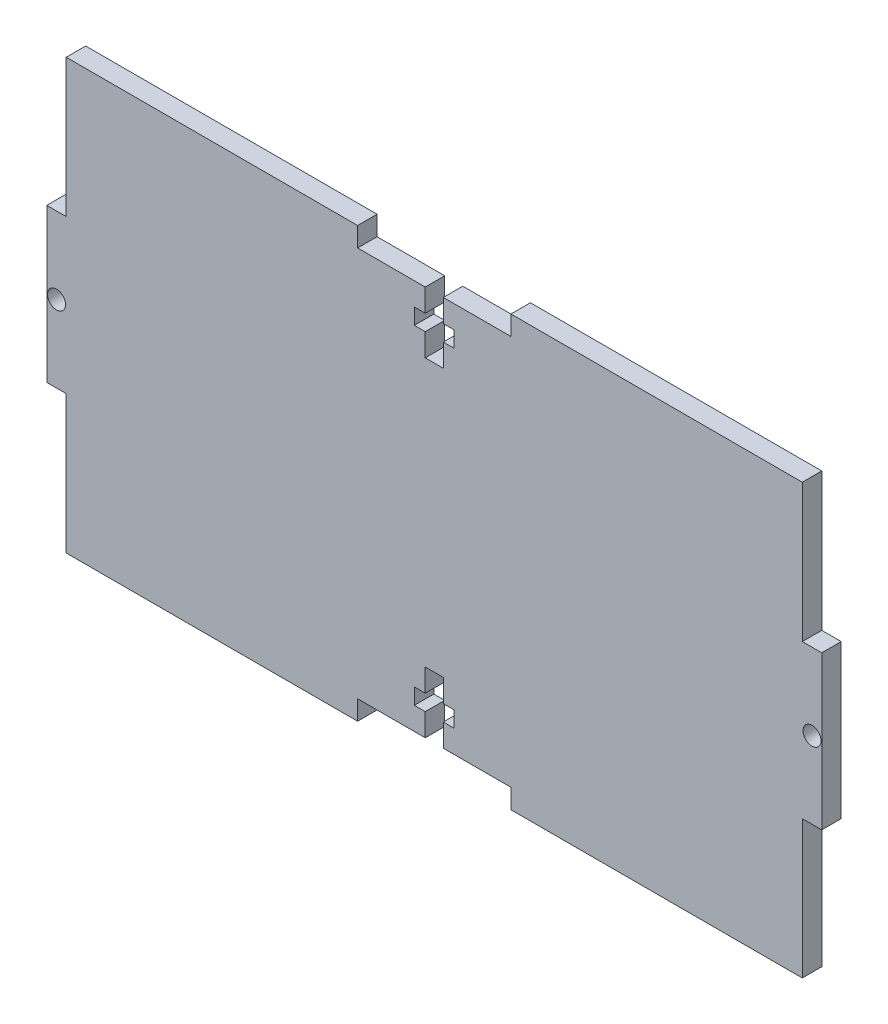
from build123d import *

# Parameters (mm, degrees)
SKETCH1_R           = 1.47
BOSS_EXTRUDE1_DEPTH = 1.5875


with BuildPart() as part:
    # Sketch1 → Boss-Extrude1 (new, symmetric)
    with BuildSketch(Plane.XY):
        Polygon((-12.5, 35), (-60, 35), (-60, 12.5), (-63.175, 12.5), (-63.175, -12.5), (-60, -12.5), (-60, -35), (-12.5, -35), (-12.5, -31.825), (-1.47, -31.825), (-1.47, -28.125), (-3.25, -28.125), (-3.25, -25.525), (-1.47, -25.525), (-1.47, -21.825), (1.47, -21.825), (1.47, -25.525), (3.25, -25.525), (3.25, -28.125), (1.47, -28.125), (1.47, -31.825), (12.5, -31.825), (12.5, -35), (60, -35), (60, -12.5), (63.175, -12.5), (63.175, 12.5), (60, 12.5), (60, 35), (12.5, 35), (12.5, 31.825), (1.47, 31.825), (1.47, 28.125), (3.25, 28.125), (3.25, 25.525), (1.47, 25.525), (1.47, 21.825), (-1.47, 21.825), (-1.47, 25.525), (-3.25, 25.525), (-3.25, 28.125), (-1.47, 28.125), (-1.47, 31.825), (-12.5, 31.825), align=None)
        with Locations((-61.5875, 0)):
            Circle(SKETCH1_R, mode=Mode.SUBTRACT)
        with Locations(Location((61.5875, 0, 0), (0, 0, 180))):
            Circle(SKETCH1_R, mode=Mode.SUBTRACT)
    extrude(amount=BOSS_EXTRUDE1_DEPTH, both=True)


solid = part.part
